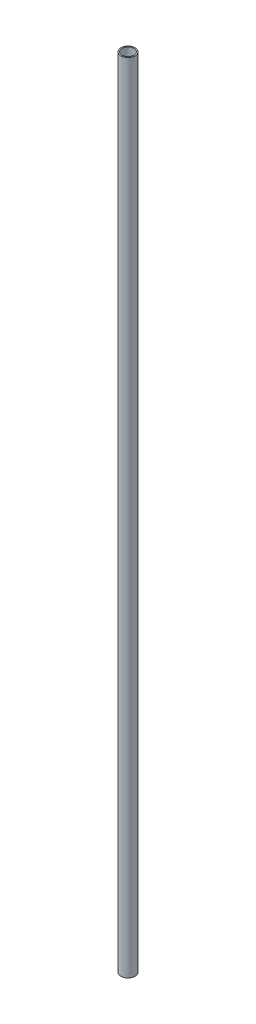
from build123d import *

# Parameters (mm, degrees)
SKETCH_1_R      = 6
SKETCH_1_R_2    = 5
EXTRUDE_1_DEPTH = 675


with BuildPart() as part:
    # 草图1 → 凸台-拉伸1 (new body)
    with BuildSketch(Plane(origin=(0, 0, 0), x_dir=(1, 0, 0), z_dir=(0, 1, 0))):
        with Locations(Location((0, 0, 0), (0, 0, 270))):
            Circle(SKETCH_1_R)
        with Locations(Location((0, 0, 0), (0, 0, 270))):
            Circle(SKETCH_1_R_2, mode=Mode.SUBTRACT)
    extrude(amount=EXTRUDE_1_DEPTH)


solid = part.part
